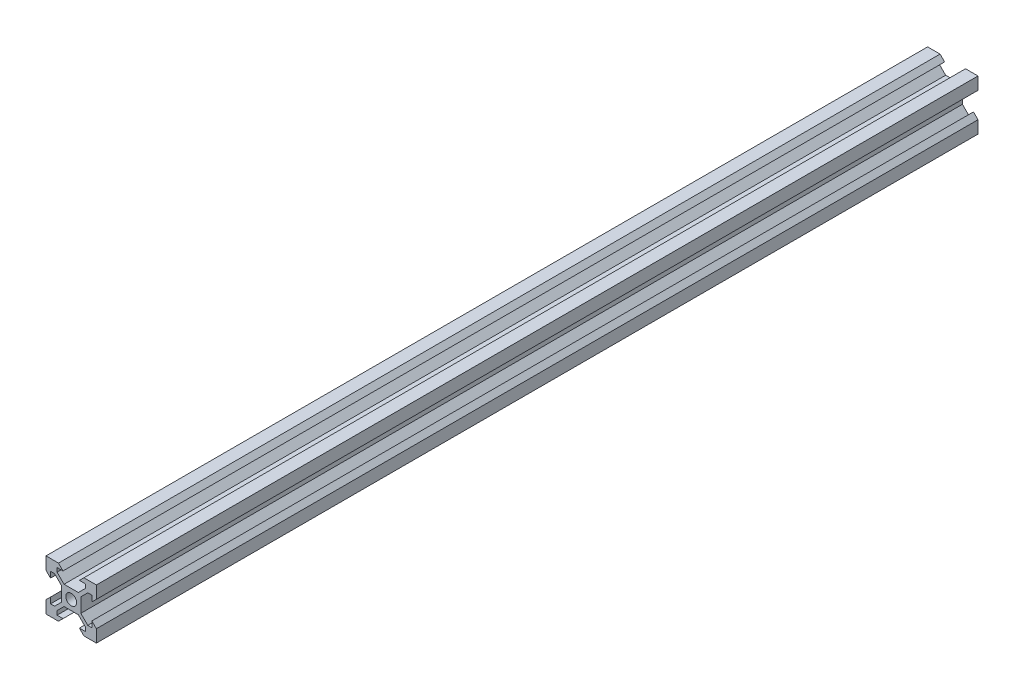
from build123d import *

# Parameters (mm, degrees)
CROQUIS1_R      = 2.15
BOSCHBASE_DEPTH = 350


with BuildPart() as part:
    # Croquis1 → BoschBase (new body)
    with BuildSketch(Plane.XY):
        Polygon((4.4, 0), (0, 0), (0, -0.56736664), (0, -4.4), (0, -4.95), (1.8, -6.75), (1.8, -4.4), (3.410050506, -4.4), (6.175, -7.164949494), (6.175, -12.835050506), (3.410050506, -15.6), (1.8, -15.6), (1.8, -13.25), (0, -15.05), (0, -15.6), (0, -20), (4.4, -20), (4.95, -20), (6.75, -18.2), (4.4, -18.2), (4.4, -16.589949494), (7.164949494, -13.825), (12.835050506, -13.825), (15.6, -16.589949494), (15.6, -18.2), (13.25, -18.2), (15.05, -20), (15.6, -20), (18.2, -20), (20, -20), (20, -15.6), (20, -15.05), (18.2, -13.25), (18.2, -15.6), (16.589949494, -15.6), (13.825, -12.835050506), (13.825, -7.164949494), (16.589949494, -4.4), (18.2, -4.4), (18.2, -6.75), (20, -4.95), (20, -4.4), (20, 0), (15.6, 0), (15.05, 0), (13.25, -1.8), (15.6, -1.8), (15.6, -3.410050506), (12.835050506, -6.175), (7.164949494, -6.175), (4.4, -3.410050506), (4.4, -1.8), (6.75, -1.8), (4.95, 0), align=None)
        with Locations((10, -10)):
            Circle(CROQUIS1_R, mode=Mode.SUBTRACT)
    extrude(amount=BOSCHBASE_DEPTH)


solid = part.part
